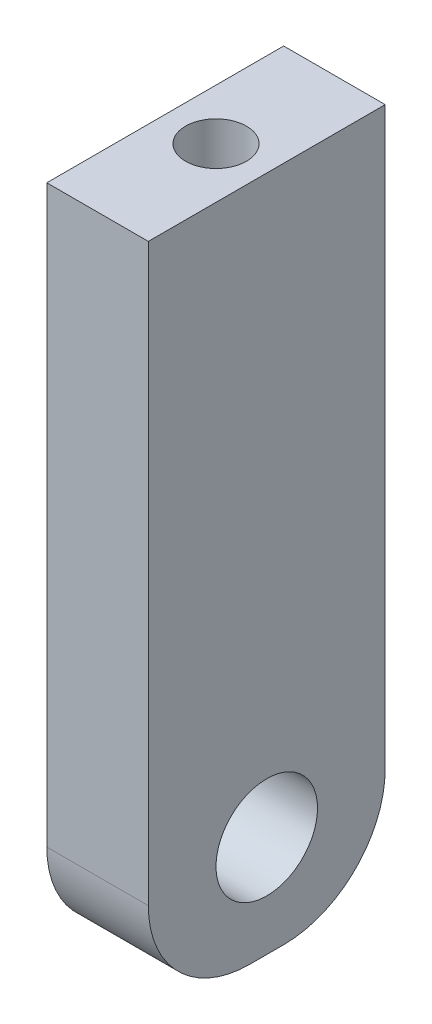
from build123d import *

# Parameters (mm, degrees)
SKETCH_1_W          = 3
SKETCH_1_H          = 20
EXTRUDE_1_DEPTH     = 7
SKETCH_4_R          = 1.5
CUT_EXTRUDE_2_DEPTH = 21.891342993
FILLET_1_R          = 3
SKETCH_3_R          = 0.9
CUT_EXTRUDE_4_DEPTH = 7


with BuildPart() as part:
    # 草图1 → 凸台-拉伸1 (new body)
    with BuildSketch(Plane.XY):
        with Locations((1.5, -9.453745451)):
            Rectangle(SKETCH_1_W, SKETCH_1_H)
    extrude(amount=EXTRUDE_1_DEPTH)

    # 草图4 → 切除-拉伸2 (cut, through all)
    with BuildSketch(Plane(origin=(3, 0, 0), x_dir=(0, 0, -1), z_dir=(1, 0, 0))):
        with Locations((-3.5, -16.453745451)):
            Circle(SKETCH_4_R)
    extrude(amount=-CUT_EXTRUDE_2_DEPTH, mode=Mode.SUBTRACT)

    # 圆角1
    fillet_1_edges = [part.edges().sort_by_distance(p)[0] for p in [
        (1.5, -19.453745451, 7),
        (1.5, -19.453745451, 0),
    ]]
    fillet(fillet_1_edges, radius=FILLET_1_R)

    # 草图3 → 切除-拉伸4 (cut)
    with BuildSketch(Plane(origin=(0, 0.546254549, 0), x_dir=(1, 0, 0), z_dir=(0, 1, 0))):
        with Locations(Location((1.5, -3.5, 0), (0, 0, 180))):
            Circle(SKETCH_3_R)
    extrude(amount=-CUT_EXTRUDE_4_DEPTH, mode=Mode.SUBTRACT)


solid = part.part
